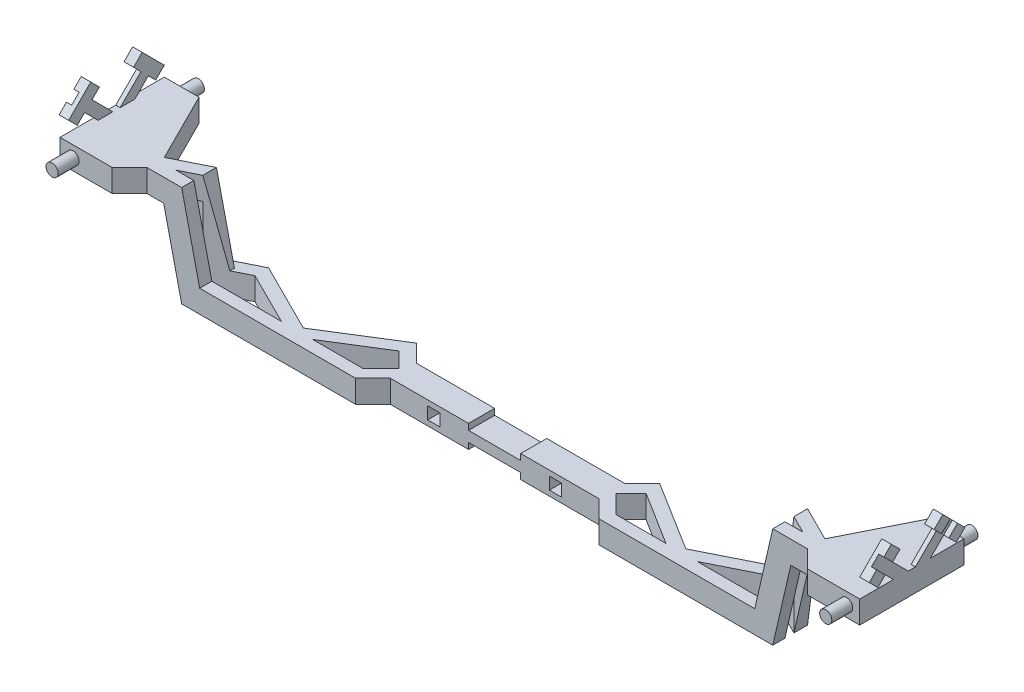
from build123d import *

# Parameters (mm, degrees)
SKETCH1_W                = 30
SKETCH1_H                = 115
BOSS_EXTRUDE1_DEPTH      = 6.5
BOSS_EXTRUDE2_DEPTH      = 21.025
BOSS_EXTRUDE2_DEPTH_BACK = 21.025
SKETCH2_R                = 1.75
BOSS_EXTRUDE3_DEPTH      = 1.25
BOSS_EXTRUDE4_DEPTH      = 1.5
CUT_EXTRUDE1_DEPTH       = 176.585884356
CUT_EXTRUDE1_DEPTH_BACK  = 176.585884356
SKETCH5_W                = 15
SKETCH5_H                = 3.5
SKETCH5_W_2              = 3.5
CUT_EXTRUDE3_DEPTH       = 179.511058418
SPLIT1_SURFACE_1_1_BACK  = 238.381
SPLIT1_SURFACE_1_1_DEPTH = 476.762
SPLIT1_SURFACE_1_2_BACK  = 238.381
SPLIT1_SURFACE_1_2_DEPTH = 476.762
SPLIT1_SURFACE_2_3_BACK  = 238.381
SPLIT1_SURFACE_2_3_DEPTH = 476.762
SPLIT1_SURFACE_2_4_BACK  = 238.381
SPLIT1_SURFACE_2_4_DEPTH = 476.762
BOSS_EXTRUDE10_DEPTH     = 3.5
BOSS_EXTRUDE11_START     = -6.08688
BOSS_EXTRUDE11_DEPTH     = 3.91312
CUT_EXTRUDE4_DEPTH       = 177.703991537
CUT_EXTRUDE4_DEPTH_BACK  = 177.703991537


with BuildPart() as part:
    # Sketch1 → Boss-Extrude1 (new body)
    with BuildSketch(Plane(origin=(0, 0, 0), x_dir=(0, 0, 1), z_dir=(0, -1, 0))):
        Rectangle(SKETCH1_W, SKETCH1_H)
    extrude(amount=-BOSS_EXTRUDE1_DEPTH)

    # Sketch2 → Boss-Extrude2 (add, two sides: drawn at the far end of the back side and taken through both)
    with BuildSketch(Plane.XY.offset(-BOSS_EXTRUDE2_DEPTH_BACK)):
        with Locations(Location((-53.75, 3.25, 0), (0, 0, 180))):
            Circle(SKETCH2_R)
    extrude(amount=BOSS_EXTRUDE2_DEPTH + BOSS_EXTRUDE2_DEPTH_BACK)

    # Sketch4 → Boss-Extrude3 (add)
    with BuildSketch(Plane.ZY.offset(57.5)):
        Polygon((-1.044718626, 6.5), (-5.287359313, 6.5), (0, 1.212640687), (5.287359313, 6.5), (1.044718626, 6.5), (0, 5.455281374), align=None)
        Polygon((7.037359313, 12.492640687), (1.044718626, 6.5), (5.287359313, 6.5), (9.158679656, 10.371320344), align=None)
        Polygon((9.524051427, 14.964876926), (7.037359313, 12.492640687), (9.158679656, 10.371320344), (11.639169892, 12.837390757), align=None)
        Polygon((4.916038969, 14.613961031), (7.037359313, 12.492640687), (9.524051427, 14.964876926), (7.401708122, 17.099630183), align=None)
        Polygon((11.639169892, 12.837390757), (9.158679656, 10.371320344), (11.28, 8.25), (13.747117437, 10.717117437), align=None)
        Polygon((-7.037359313, 12.492640687), (-9.158679656, 10.371320344), (-5.287359313, 6.5), (-1.044718626, 6.5), align=None)
        Polygon((-11.28, 8.25), (-9.158679656, 10.371320344), (-11.639169892, 12.837390757), (-13.747117437, 10.717117437), align=None)
        Polygon((-11.639169892, 12.837390757), (-9.158679656, 10.371320344), (-7.037359313, 12.492640687), (-9.524051427, 14.964876926), align=None)
        Polygon((-9.524051427, 14.964876926), (-7.037359313, 12.492640687), (-4.916038969, 14.613961031), (-7.401708122, 17.099630183), align=None)
    extrude(amount=-BOSS_EXTRUDE3_DEPTH)

    # Sketch4<3> → Boss-Extrude4 (add)
    with BuildSketch(Plane.ZY.offset(57.5)):
        Polygon((-11.28, 8.25), (-9.158679656, 10.371320344), (-11.639169892, 12.837390757), (-13.747117437, 10.717117437), align=None)
        Polygon((-9.524051427, 14.964876926), (-7.037359313, 12.492640687), (-4.916038969, 14.613961031), (-7.401708122, 17.099630183), align=None)
        Polygon((4.916038969, 14.613961031), (7.037359313, 12.492640687), (9.524051427, 14.964876926), (7.401708122, 17.099630183), align=None)
        Polygon((11.639169892, 12.837390757), (9.158679656, 10.371320344), (11.28, 8.25), (13.747117437, 10.717117437), align=None)
    extrude(amount=BOSS_EXTRUDE4_DEPTH)

    # Mirror1: part across plane


with BuildPart() as part_1:
    add(part.part)
    add(part.part.mirror(Plane(origin=(57.5, 0, 0), x_dir=(0, 0, 1), z_dir=(1, 0, 0))))

    # Sketch6 → Cut-Extrude1 (cut, two sides: drawn at the far end of the back side and taken through both)
    with BuildSketch(Plane(origin=(0, 6.5, 0), x_dir=(1, 0, 0), z_dir=(0, 1, 0)).offset(-CUT_EXTRUDE1_DEPTH_BACK)):
        Polygon((162.5, 15), (-47.5, 15), (-37.5, -5), (-17.5, 5), (2.5, -5), (22.5, 7.5), (27.5, 2.5), (87.5, 2.5), (92.5, 7.5), (112.5, -5), (132.5, 5), (152.5, -5), align=None)
        Polygon((87.5, -5), (27.5, -5), (22.5, -10), (-37.5, -10), (-42.5, -15), (157.5, -15), (152.5, -10), (92.5, -10), align=None)
        Polygon((-2.326237921, -6.5), (-32.673762079, -6.5), (-17.5, 1.086881039), align=None)
        Polygon((25.025126266, -2.525126266), (21.050252532, -6.5), (6.703786792, -6.5), (21.993919555, 3.056332977), (25.025126266, 0.025126266), (26.300252532, -1.25), align=None)
        Polygon((93.949747468, -6.5), (108.296213208, -6.5), (93.006080445, 3.056332977), (89.974873734, 0.025126266), (88.699747468, -1.25), (89.974873734, -2.525126266), align=None)
        Polygon((132.5, 1.086881039), (117.326237921, -6.5), (147.673762079, -6.5), align=None)
    extrude(amount=CUT_EXTRUDE1_DEPTH + CUT_EXTRUDE1_DEPTH_BACK, mode=Mode.SUBTRACT)

    # Sketch5 → Cut-Extrude3 (cut, through all)
    with BuildSketch(Plane.XY.offset(-15)):
        with Locations((57.5, 6.5)):
            Rectangle(SKETCH5_W, SKETCH5_H)
        with Locations((40, 3.25)):
            Rectangle(SKETCH5_W_2, SKETCH5_H)
        with Locations((75, 3.25)):
            Rectangle(SKETCH5_W_2, SKETCH5_H)
        with Locations((57.5, 0)):
            Rectangle(SKETCH5_W, SKETCH5_H)
    extrude(amount=CUT_EXTRUDE3_DEPTH, mode=Mode.SUBTRACT)


with BuildPart() as body_2:
    # Split1: the piece behind the surface
    add(part_1.part)
    # Split1 surface 1: a surface, the sketch's curves swept straight by 476.762 mm
    with BuildLine(Plane(origin=(0, 0, 0), x_dir=(1, 0, 0), z_dir=(0, 1, 0)).offset(-SPLIT1_SURFACE_1_1_BACK), mode=Mode.PRIVATE) as split1_surface_1_1_path:
        Line((-27.5, 9.688914823), (-27.5, -15.311085177))
    split1_surface_1_1 = Shell.extrude(split1_surface_1_1_path.wire(), (0 * SPLIT1_SURFACE_1_1_DEPTH, 1 * SPLIT1_SURFACE_1_1_DEPTH, 0 * SPLIT1_SURFACE_1_1_DEPTH))
    split(bisect_by=split1_surface_1_1, keep=Keep.BOTTOM)


with BuildPart() as part_2:
    add(part_1.part)

    # Split1: split by a surface, the side it looks to stays
    # Split1 surface 1: a surface, the sketch's curves swept straight by 476.762 mm
    with BuildLine(Plane(origin=(0, 0, 0), x_dir=(1, 0, 0), z_dir=(0, 1, 0)).offset(-SPLIT1_SURFACE_1_2_BACK), mode=Mode.PRIVATE) as split1_surface_1_2_path:
        Line((-27.5, 9.688914823), (-27.5, -15.311085177))
    split1_surface_1_2 = Shell.extrude(split1_surface_1_2_path.wire(), (0 * SPLIT1_SURFACE_1_2_DEPTH, 1 * SPLIT1_SURFACE_1_2_DEPTH, 0 * SPLIT1_SURFACE_1_2_DEPTH))
    split(bisect_by=split1_surface_1_2, keep=Keep.TOP)


with BuildPart() as body_3:
    # Split1 2: the piece behind the surface
    add(part_2.part)
    # Split1 surface 2: a surface, the sketch's curves swept straight by 476.762 mm
    with BuildLine(Plane(origin=(0, 0, 0), x_dir=(1, 0, 0), z_dir=(0, 1, 0)).offset(-SPLIT1_SURFACE_2_3_BACK), mode=Mode.PRIVATE) as split1_surface_2_3_path:
        Line((142.5, 6.689515731), (142.5, -18.310484269))
    split1_surface_2_3 = Shell.extrude(split1_surface_2_3_path.wire(), (0 * SPLIT1_SURFACE_2_3_DEPTH, 1 * SPLIT1_SURFACE_2_3_DEPTH, 0 * SPLIT1_SURFACE_2_3_DEPTH))
    split(bisect_by=split1_surface_2_3, keep=Keep.BOTTOM)


with BuildPart() as part_3:
    add(part_2.part)

    # Split1 2: split by a surface, the side it looks to stays
    # Split1 surface 2: a surface, the sketch's curves swept straight by 476.762 mm
    with BuildLine(Plane(origin=(0, 0, 0), x_dir=(1, 0, 0), z_dir=(0, 1, 0)).offset(-SPLIT1_SURFACE_2_4_BACK), mode=Mode.PRIVATE) as split1_surface_2_4_path:
        Line((142.5, 6.689515731), (142.5, -18.310484269))
    split1_surface_2_4 = Shell.extrude(split1_surface_2_4_path.wire(), (0 * SPLIT1_SURFACE_2_4_DEPTH, 1 * SPLIT1_SURFACE_2_4_DEPTH, 0 * SPLIT1_SURFACE_2_4_DEPTH))
    split(bisect_by=split1_surface_2_4, keep=Keep.TOP)

    add(body_2.part)  # Boss-Extrude10 merges body 2


with BuildPart() as body_3_1:
    # Body-Move/Copy1: moved
    add(body_3.part.moved(Location((0, -22.5, 0))))


with BuildPart() as part_4:
    add(part_3.part)

    add(body_3_1.part)  # Boss-Extrude10 merges body 3
    # Sketch9 → Boss-Extrude10 (add)
    with BuildSketch(Plane.XY.offset(10)):
        Polygon((-27.5, -22.5), (-32.674762701, 0), (-27.5, 6.5), (-22.325237299, -16), align=None)
        Polygon((142.5, -22.5), (137.325237299, -16), (142.5, 6.5), (147.674762701, 0), align=None)
    extrude(amount=-BOSS_EXTRUDE10_DEPTH)

    # Sketch9<3> → Boss-Extrude11 (add)
    with BuildSketch(Plane.XY.offset(10).offset(BOSS_EXTRUDE11_START)):
        Polygon((-27.5, -22.5), (-32.674762701, 0), (-27.5, 6.5), (-22.325237299, -16), align=None)
        Polygon((142.5, -22.5), (137.325237299, -16), (142.5, 6.5), (147.674762701, 0), align=None)
    extrude(amount=-BOSS_EXTRUDE11_DEPTH)

    # Sketch11 → Cut-Extrude4 (cut, two sides: drawn at the far end of the back side and taken through both)
    with BuildSketch(Plane(origin=(0, 0, 0), x_dir=(1, 0, 0), z_dir=(0, 1, 0)).offset(-CUT_EXTRUDE4_DEPTH_BACK)):
        Polygon((-37.5, -5), (-17.5, 5), (-19.736067977, 9.472135955), (-39.736067977, -0.527864045), align=None)
        Polygon((-17.5, 1.086881039), (-32.673762079, -6.5), (-2.326237921, -6.5), align=None)
        Polygon((117.326237921, -6.5), (132.5, 1.086881039), (147.673762079, -6.5), align=None)
        Polygon((154.736067977, -0.527864045), (152.5, -5), (132.5, 5), (134.736067977, 9.472135955), align=None)
    extrude(amount=CUT_EXTRUDE4_DEPTH + CUT_EXTRUDE4_DEPTH_BACK, mode=Mode.SUBTRACT)


solid = part_4.part
